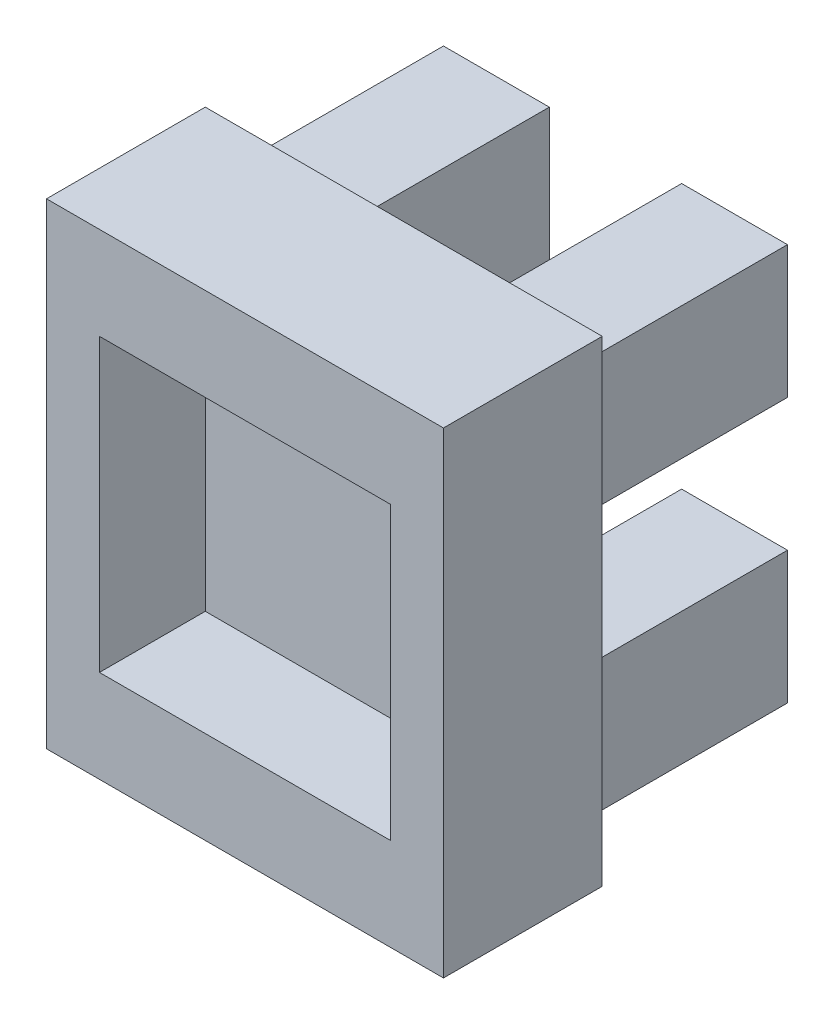
from build123d import *

# Parameters (mm, degrees)
SKETCH1_W           = 15
SKETCH1_H           = 18
BOSS_EXTRUDE1_DEPTH = 3
SKETCH2_W           = 11
SKETCH2_H           = 11
CUT_EXTRUDE1_DEPTH  = 4
SKETCH4_W           = 4
SKETCH4_H           = 5
BOSS_EXTRUDE2_DEPTH = 8


with BuildPart() as part:
    # Sketch1 → Boss-Extrude1 (new, symmetric)
    with BuildSketch(Plane.XY):
        Rectangle(SKETCH1_W, SKETCH1_H)
    extrude(amount=BOSS_EXTRUDE1_DEPTH, both=True)

    # Sketch2 → Cut-Extrude1 (cut)
    with BuildSketch(Plane.XY.offset(3)):
        Rectangle(SKETCH2_W, SKETCH2_H)
    extrude(amount=-CUT_EXTRUDE1_DEPTH, mode=Mode.SUBTRACT)

    # Sketch4 → Boss-Extrude2 (add)
    with BuildSketch(Plane(origin=(0, 0, -3), x_dir=(-1, 0, 0), z_dir=(0, 0, -1))):
        with Locations((-4.5, 5)):
            Rectangle(SKETCH4_W, SKETCH4_H)
        with Locations((4.5, 5)):
            Rectangle(SKETCH4_W, SKETCH4_H)
        with Locations((4.5, -5)):
            Rectangle(SKETCH4_W, SKETCH4_H)
        with Locations((-4.5, -5)):
            Rectangle(SKETCH4_W, SKETCH4_H)
    extrude(amount=BOSS_EXTRUDE2_DEPTH)


solid = part.part
